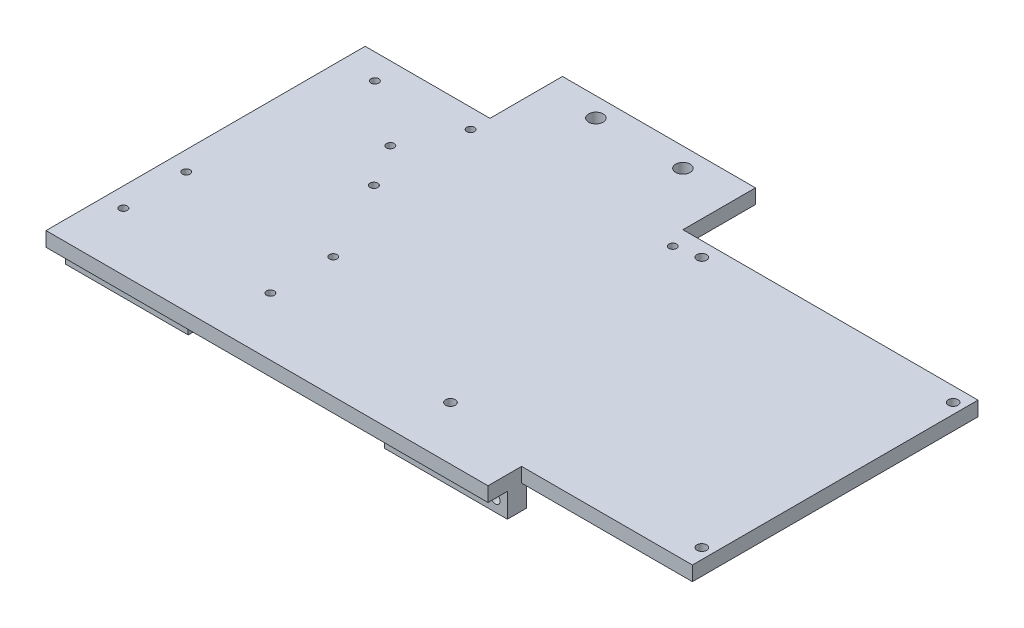
from build123d import *

# Parameters (mm, degrees)
SKETCH1_W           = 116.078
SKETCH1_H           = 102.87
BOSS_EXTRUDE1_DEPTH = 3.81
SKETCH2_R           = 1.905
SKETCH2_W           = 32.766
SKETCH2_H           = 19.05
SKETCH2_W_2         = 32.639
CUT_EXTRUDE1_DEPTH  = 3.81
SKETCH3_W           = 32.258
SKETCH3_H           = 5.08
BOSS_EXTRUDE2_DEPTH = 6.35
SKETCH4_R           = 1.27
CUT_EXTRUDE2_DEPTH  = 5.08
SKETCH5_R           = 1.016
CUT_EXTRUDE4_DEPTH  = 3.81
SKETCH6_W           = 70
SKETCH6_H           = 75
BOSS_EXTRUDE3_DEPTH = 3.81
SKETCH7_R           = 1.27
CUT_EXTRUDE5_DEPTH  = 3.81


with BuildPart() as part:
    # Sketch1 → Boss-Extrude1 (new body)
    with BuildSketch(Plane(origin=(0, 0, 0), x_dir=(1, 0, 0), z_dir=(0, 1, 0))):
        with Locations((58.039, 51.435)):
            Rectangle(SKETCH1_W, SKETCH1_H)
    extrude(amount=BOSS_EXTRUDE1_DEPTH)

    # Sketch2 → Cut-Extrude1 (cut)
    with BuildSketch(Plane(origin=(0, 3.81, 0), x_dir=(1, 0, 0), z_dir=(0, 1, 0))):
        with Locations(Location((46.609, 97.79, 0), (0, 0, 270))):
            Circle(SKETCH2_R)
        with Locations(Location((69.469, 97.79, 0), (0, 0, 270))):
            Circle(SKETCH2_R)
        with Locations((16.383, 93.345)):
            Rectangle(SKETCH2_W, SKETCH2_H)
        with Locations((99.7585, 93.345)):
            Rectangle(SKETCH2_W_2, SKETCH2_H)
    extrude(amount=-CUT_EXTRUDE1_DEPTH, mode=Mode.SUBTRACT)

    # Sketch3 → Boss-Extrude2 (add)
    with BuildSketch(Plane.XZ):
        with Locations((16.129, -7.62)):
            Rectangle(SKETCH3_W, SKETCH3_H)
        with Locations((99.949, -7.62)):
            Rectangle(SKETCH3_W, SKETCH3_H)
    extrude(amount=BOSS_EXTRUDE2_DEPTH)

    # Sketch4 → Cut-Extrude2 (cut)
    with BuildSketch(Plane.XY.offset(-5.08)):
        with Locations((3.175, -3.175)):
            Circle(SKETCH4_R)
        with Locations((11.811, -3.175)):
            Circle(SKETCH4_R)
        with Locations((20.447, -3.175)):
            Circle(SKETCH4_R)
        with Locations((29.083, -3.175)):
            Circle(SKETCH4_R)
        with Locations((86.995, -3.175)):
            Circle(SKETCH4_R)
        with Locations((95.631, -3.175)):
            Circle(SKETCH4_R)
        with Locations((104.267, -3.175)):
            Circle(SKETCH4_R)
        with Locations((112.903, -3.175)):
            Circle(SKETCH4_R)
    extrude(amount=-CUT_EXTRUDE2_DEPTH, mode=Mode.SUBTRACT)

    # Sketch5 → Cut-Extrude4 (cut)
    with BuildSketch(Plane(origin=(0, 3.81, 0), x_dir=(1, 0, 0), z_dir=(0, 1, 0))):
        with Locations(Location((25.908, 64.516, 0), (0, 0, 270))):
            Circle(SKETCH5_R)
        with Locations(Location((9.144, 77.216, 0), (0, 0, 270))):
            Circle(SKETCH5_R)
        with Locations(Location((32.766, 78.74, 0), (0, 0, 270))):
            Circle(SKETCH5_R)
        with Locations(Location((85.852, 78.74, 0), (0, 0, 270))):
            Circle(SKETCH5_R)
        with Locations(Location((32.766, 53.34, 0), (0, 0, 270))):
            Circle(SKETCH5_R)
        with Locations(Location((5.08, 31.75, 0), (0, 0, 270))):
            Circle(SKETCH5_R)
        with Locations(Location((43.688, 31.75, 0), (0, 0, 270))):
            Circle(SKETCH5_R)
        with Locations(Location((5.08, 15.24, 0), (0, 0, 270))):
            Circle(SKETCH5_R)
        with Locations(Location((43.688, 15.24, 0), (0, 0, 270))):
            Circle(SKETCH5_R)
    extrude(amount=-CUT_EXTRUDE4_DEPTH, mode=Mode.SUBTRACT)

    # Sketch6 → Boss-Extrude3 (add)
    with BuildSketch(Plane(origin=(0, 3.81, 0), x_dir=(1, 0, 0), z_dir=(0, 1, 0))):
        with Locations((125.932, 46.32)):
            Rectangle(SKETCH6_W, SKETCH6_H)
    extrude(amount=-BOSS_EXTRUDE3_DEPTH)

    # Sketch7 → Cut-Extrude5 (cut)
    with BuildSketch(Plane(origin=(0, 3.81, 0), x_dir=(1, 0, 0), z_dir=(0, 1, 0))):
        with Locations(Location((92.202, 14.01, 0), (0, 0, 270))):
            Circle(SKETCH7_R)
        with Locations(Location((92.202, 80.01, 0), (0, 0, 270))):
            Circle(SKETCH7_R)
        with Locations(Location((158.202, 80.01, 0), (0, 0, 270))):
            Circle(SKETCH7_R)
        with Locations(Location((158.202, 14.01, 0), (0, 0, 270))):
            Circle(SKETCH7_R)
    extrude(amount=-CUT_EXTRUDE5_DEPTH, mode=Mode.SUBTRACT)


solid = part.part
